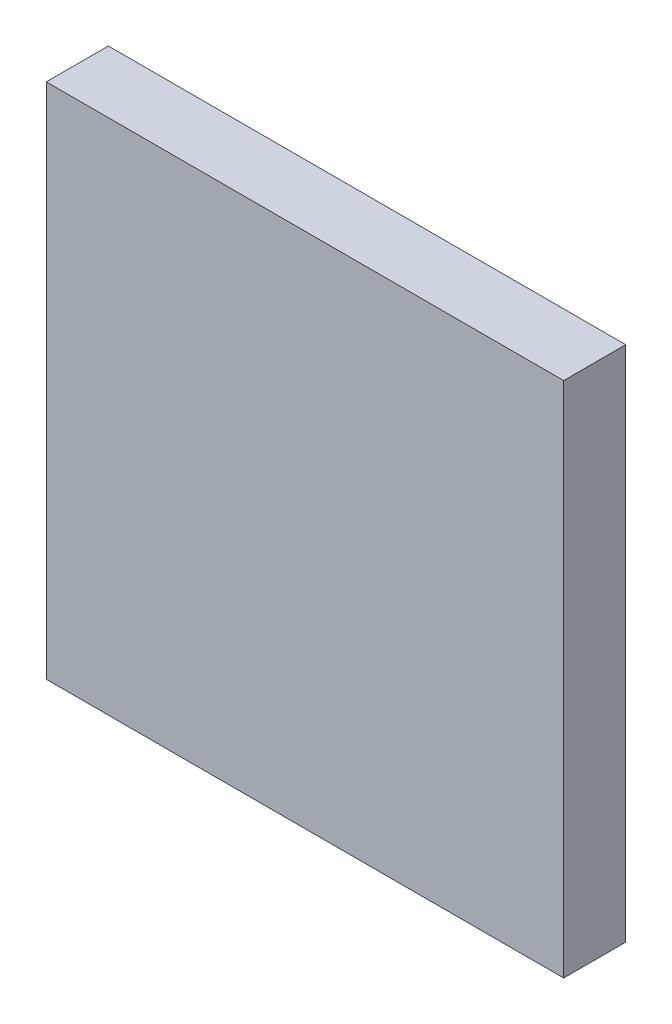
from build123d import *

# Parameters (mm, degrees)
SKETCH1_W           = 25
SKETCH1_H           = 25
BOSS_EXTRUDE1_DEPTH = 3


with BuildPart() as part:
    # Sketch1 → Boss-Extrude1 (new body)
    with BuildSketch(Plane.XY):
        with Locations((12.5, -12.5)):
            Rectangle(SKETCH1_W, SKETCH1_H)
    extrude(amount=BOSS_EXTRUDE1_DEPTH)


solid = part.part
